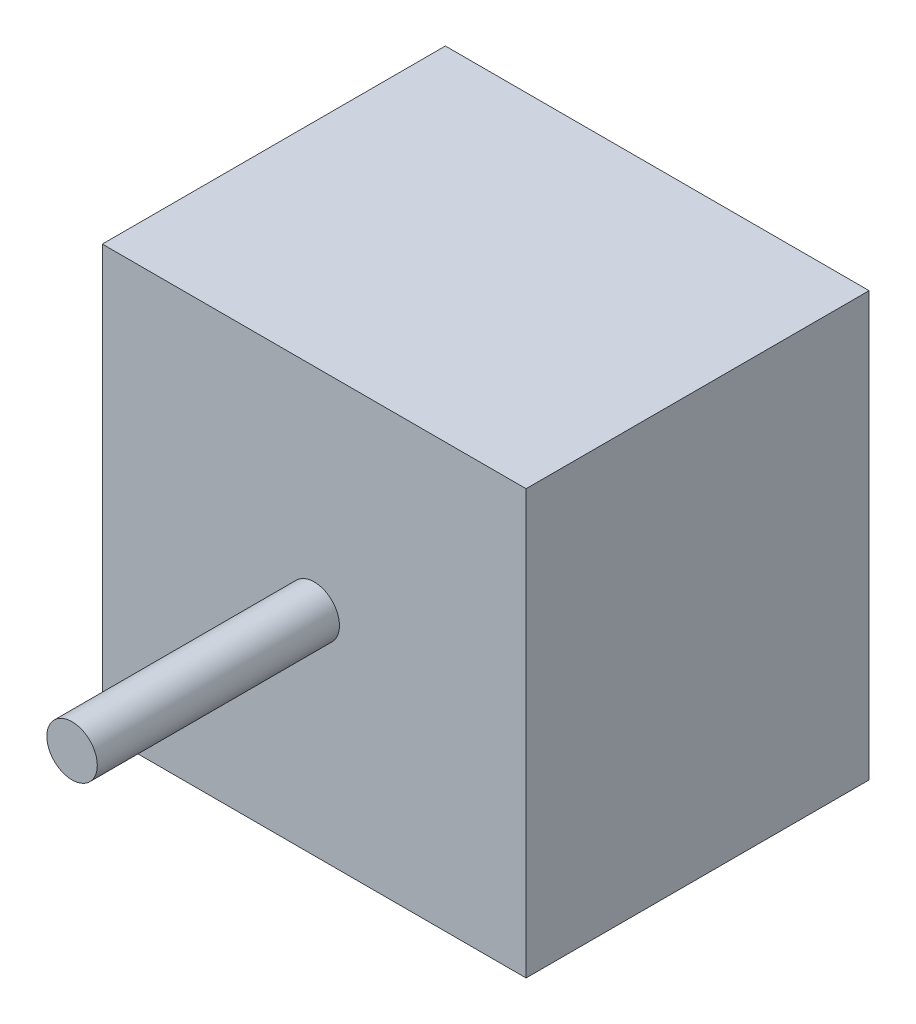
from build123d import *

# Parameters (mm, degrees)
ESQUISSE1_W        = 42
ESQUISSE1_H        = 42
BOSS_EXTRU_1_DEPTH = 34
ESQUISSE2_R        = 2.5
BOSS_EXTRU_2_DEPTH = 24


with BuildPart() as part:
    # Esquisse1 → Boss.-Extru.1 (new body)
    with BuildSketch(Plane.XY):
        Rectangle(ESQUISSE1_W, ESQUISSE1_H)
    extrude(amount=BOSS_EXTRU_1_DEPTH)

    # Esquisse2 → Boss.-Extru.2 (add)
    with BuildSketch(Plane.XY.offset(34)):
        Circle(ESQUISSE2_R)
    extrude(amount=BOSS_EXTRU_2_DEPTH)


solid = part.part
